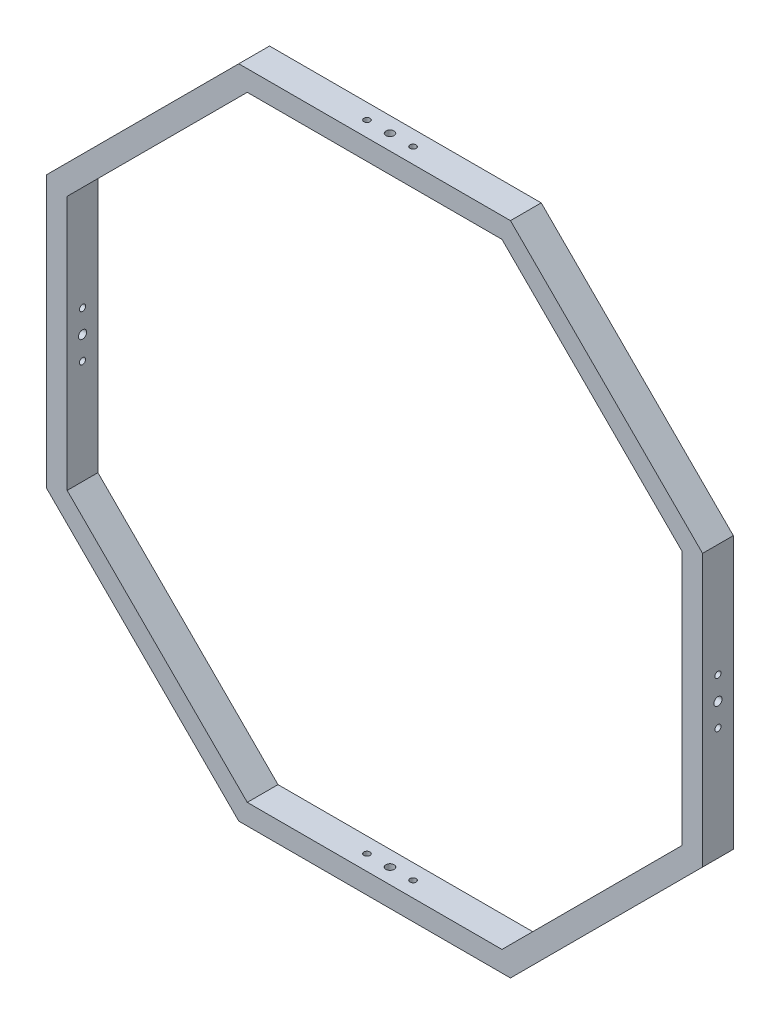
from build123d import *

# Parameters (mm, degrees)
BOSS_EXTRUDE1_DEPTH = 60
SKETCH2_R           = 8
SKETCH2_R_2         = 6
CUT_EXTRUDE1_DEPTH  = 1899
SKETCH3_R           = 8
SKETCH3_R_2         = 6
CUT_EXTRUDE2_DEPTH  = 1899


with BuildPart() as part:
    # Sketch1 → Boss-Extrude1 (new body)
    with BuildSketch(Plane.XY):
        Polygon((265.096679919, 640), (-265.096679919, 640), (-640, 265.096679919), (-640, -265.096679919), (-265.096679919, -640), (265.096679919, -640), (640, -265.096679919), (640, 265.096679919), align=None)
        Polygon((600, -248.528137424), (600, 248.528137424), (248.528137424, 600), (-248.528137424, 600), (-600, 248.528137424), (-600, -248.528137424), (-248.528137424, -600), (248.528137424, -600), align=None, mode=Mode.SUBTRACT)
    extrude(amount=BOSS_EXTRUDE1_DEPTH)

    # Sketch2 → Cut-Extrude1 (cut)
    with BuildSketch(Plane(origin=(640, 0, 0), x_dir=(0, 0, -1), z_dir=(1, 0, 0))):
        with Locations((-30, 0)):
            Circle(SKETCH2_R)
        with Locations((-30, 45)):
            Circle(SKETCH2_R_2)
        with Locations((-30, -45)):
            Circle(SKETCH2_R_2)
    extrude(amount=-CUT_EXTRUDE1_DEPTH, mode=Mode.SUBTRACT)

    # Sketch3 → Cut-Extrude2 (cut)
    with BuildSketch(Plane.XZ.offset(640)):
        with Locations(Location((0, 30, 0), (0, 0, 270))):
            Circle(SKETCH3_R)
        with Locations(Location((-45, 30, 0), (0, 0, 270))):
            Circle(SKETCH3_R_2)
        with Locations(Location((45, 30, 0), (0, 0, 270))):
            Circle(SKETCH3_R_2)
    extrude(amount=-CUT_EXTRUDE2_DEPTH, mode=Mode.SUBTRACT)


solid = part.part
